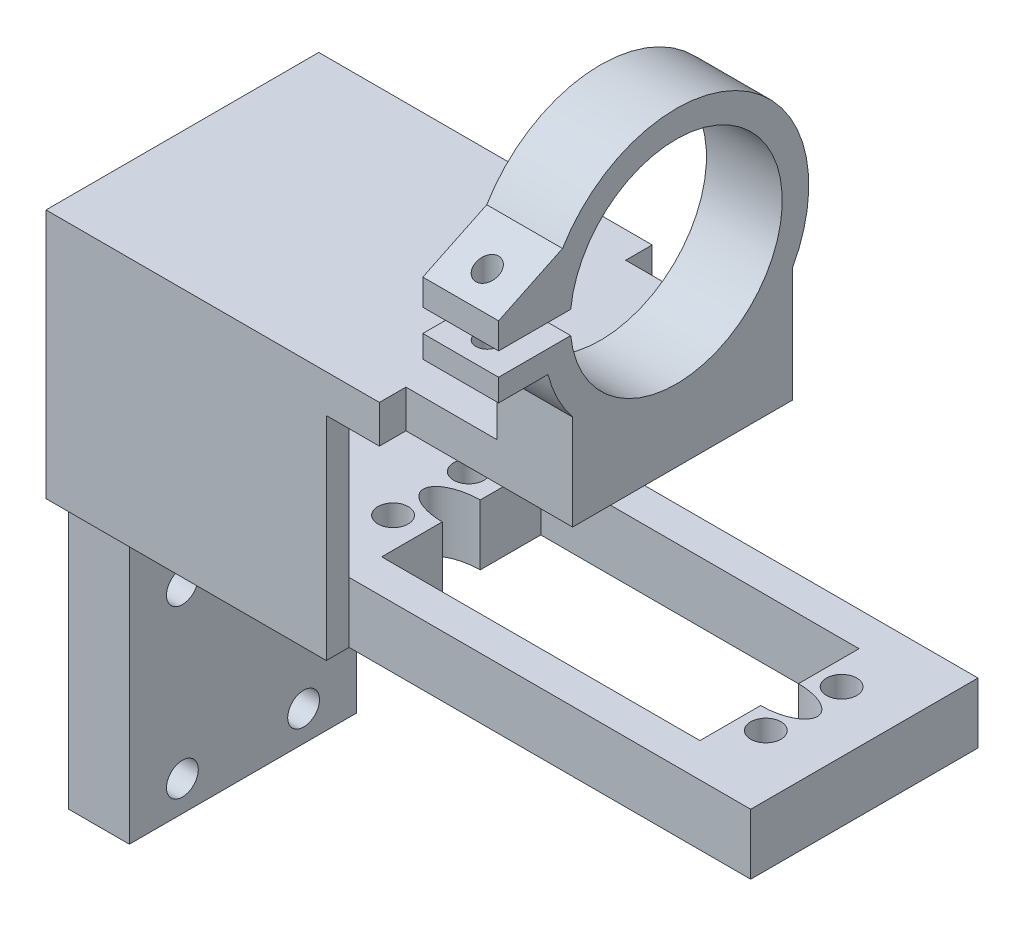
from build123d import *

# Parameters (mm, degrees)
SKETCH_1_W          = 82
SKETCH_1_H          = 30
EXTRUDE_1_DEPTH     = 8
SKETCH_2_R          = 2
CUT_EXTRUDE_1_DEPTH = 8
SKETCH_4_W          = 8
SKETCH_4_H          = 30
EXTRUDE_2_DEPTH     = 45
EXTRUDE_5_DEPTH     = 30
SKETCH_15_R         = 2.1
CUT_EXTRUDE_2_DEPTH = 10
SKETCH_17_W         = 37
SKETCH_17_H         = 3
EXTRUDE_6_DEPTH     = 20
EXTRUDE_6_2_DEPTH   = 20
SKETCH_18_W         = 66
SKETCH_18_H         = 36
EXTRUDE_7_DEPTH     = 5
SKETCH_19_W         = 37
SKETCH_19_H         = 3
EXTRUDE_8_DEPTH     = 8
SKETCH_20_W         = 22
SKETCH_20_H         = 3.5
CUT_EXTRUDE_3_DEPTH = 5
SKETCH_21_R         = 17.5
SKETCH_21_R_2       = 14
EXTRUDE_9_DEPTH     = 10
SKETCH_22_W         = 7.811366884
SKETCH_22_H         = 3
CUT_EXTRUDE_4_DEPTH = 10
EXTRUDE_10_DEPTH    = 10
SKETCH_24_R         = 1.5
CUT_EXTRUDE_5_DEPTH = 13


with BuildPart() as part:
    # 草圖1 → 填料-伸長1 (new body)
    with BuildSketch(Plane(origin=(0, 0, 0), x_dir=(1, 0, 0), z_dir=(0, 1, 0))):
        with Locations((41, 15)):
            Rectangle(SKETCH_1_W, SKETCH_1_H)
    extrude(amount=EXTRUDE_1_DEPTH)

    # 草圖2 → 除料-伸長1 (cut)
    with BuildSketch(Plane(origin=(0, 8, 0), x_dir=(1, 0, 0), z_dir=(0, 1, 0))):
        with Locations(Location((74, 20, 0), (0, 0, 270))):
            Circle(SKETCH_2_R)
        with Locations(Location((74, 10, 0), (0, 0, 270))):
            Circle(SKETCH_2_R)
        with Locations(Location((24.8, 20, 0), (0, 0, 270))):
            Circle(SKETCH_2_R)
        with Locations(Location((24.8, 10, 0), (0, 0, 270))):
            Circle(SKETCH_2_R)
        with BuildLine():
            Line((28.8, 25.5), (70.8, 25.5))
            Line((70.8, 25.5), (70.8, 17.5))
            add(Edge.make_bspline(
                [(70.8, 12.5), (75.8, 12.5), (75.8, 15), (75.8, 17.5), (70.8, 17.5)],
                knots=[4.71238898, 4.71238898, 4.71238898, 6.283185307, 6.283185307, 7.853981634, 7.853981634, 7.853981634], degree=2, weights=[1, 0.707106781, 1, 0.707106781, 1]))
            Line((70.8, 12.5), (70.8, 4.5))
            Line((70.8, 4.5), (28.8, 4.5))
            Line((28.8, 4.5), (28.8, 12.5))
            add(Edge.make_bspline(
                [(28.8, 17.5), (23.8, 17.5), (23.8, 15), (23.8, 12.5), (28.8, 12.5)],
                knots=[1.570796327, 1.570796327, 1.570796327, 3.141592654, 3.141592654, 4.71238898, 4.71238898, 4.71238898], degree=2, weights=[1, 0.707106781, 1, 0.707106781, 1]))
            Line((28.8, 17.5), (28.8, 25.5))
        make_face()
    extrude(amount=-CUT_EXTRUDE_1_DEPTH, mode=Mode.SUBTRACT)

    # 草圖4 → 填料-伸長2 (add)
    with BuildSketch(Plane(origin=(0, 8, 0), x_dir=(1, 0, 0), z_dir=(0, 1, 0))):
        with Locations((-4, 15)):
            Rectangle(SKETCH_4_W, SKETCH_4_H)
    extrude(amount=-EXTRUDE_2_DEPTH)

    # 草圖14 → 填料-伸長5 (add)
    with BuildSketch(Plane.XY):
        Polygon((0, 0), (0, -2), (2, 0), align=None)
    extrude(amount=-EXTRUDE_5_DEPTH)

    # 草圖15 → 除料-伸長2 (cut)
    with BuildSketch(Plane(origin=(0, 0, 0), x_dir=(0, 0, -1), z_dir=(1, 0, 0))):
        with Locations((7, -33)):
            Circle(SKETCH_15_R)
        with Locations((7, -11)):
            Circle(SKETCH_15_R)
        with Locations((23, -11)):
            Circle(SKETCH_15_R)
        with Locations((23, -33)):
            Circle(SKETCH_15_R)
    extrude(amount=-CUT_EXTRUDE_2_DEPTH, mode=Mode.SUBTRACT)



with BuildPart() as body_2:
    # 草圖17 → 填料-伸長6 (new body)
    with BuildSketch(Plane(origin=(0, 8, 0), x_dir=(1, 0, 0), z_dir=(0, 1, 0))):
        with Locations((10.5, -1.5)):
            Rectangle(SKETCH_17_W, SKETCH_17_H)
    extrude(amount=EXTRUDE_6_DEPTH)



with BuildPart() as body_3:
    # 草圖17 → Extrude 6 2 (new body)
    with BuildSketch(Plane(origin=(0, 8, 0), x_dir=(1, 0, 0), z_dir=(0, 1, 0))):
        with Locations((10.5, 31.5)):
            Rectangle(SKETCH_17_W, SKETCH_17_H)
    extrude(amount=EXTRUDE_6_2_DEPTH)


with BuildPart() as body_2_1:
    add(body_2.part)

    add(body_3.part)  # 填料-伸長7 merges body 3
    # 草圖18 → 填料-伸長7 (add)
    with BuildSketch(Plane(origin=(0, 28, 0), x_dir=(1, 0, 0), z_dir=(0, 1, 0))):
        with Locations((25, 15)):
            Rectangle(SKETCH_18_W, SKETCH_18_H)
    extrude(amount=EXTRUDE_7_DEPTH)


with BuildPart() as part_1:
    add(part.part)

    add(body_2_1.part)  # 填料-伸長8 merges body 2
    # 草圖19 → 填料-伸長8 (add)
    with BuildSketch(Plane(origin=(0, 8, 0), x_dir=(-1, 0, 0), z_dir=(0, -1, 0))):
        with Locations((-10.5, -1.5)):
            Rectangle(SKETCH_19_W, SKETCH_19_H)
        with Locations((-10.5, 31.5)):
            Rectangle(SKETCH_19_W, SKETCH_19_H)
    extrude(amount=EXTRUDE_8_DEPTH)

    # 草圖20 → 除料-伸長3 (cut)
    with BuildSketch(Plane(origin=(0, 33, 0), x_dir=(1, 0, 0), z_dir=(0, 1, 0))):
        with Locations((47, 31.25)):
            Rectangle(SKETCH_20_W, SKETCH_20_H)
        with Locations((47, -1.25)):
            Rectangle(SKETCH_20_W, SKETCH_20_H)
    extrude(amount=-CUT_EXTRUDE_3_DEPTH, mode=Mode.SUBTRACT)



with BuildPart() as body_2_2:
    # 草圖21 → 填料-伸長9 (new body)
    with BuildSketch(Plane(origin=(58, 0, 0), x_dir=(0, 0, -1), z_dir=(1, 0, 0))):
        with Locations((14.166762284, 51.5)):
            Circle(SKETCH_21_R)
        with Locations((14.166762284, 51.5)):
            Circle(SKETCH_21_R_2, mode=Mode.SUBTRACT)
    extrude(amount=-EXTRUDE_9_DEPTH)

    # 草圖22 → 除料-伸長4 (cut)
    with BuildSketch(Plane(origin=(58, 0, 0), x_dir=(0, 0, -1), z_dir=(1, 0, 0))):
        with Locations((-1.754307307, 51.514473438)):
            Rectangle(SKETCH_22_W, SKETCH_22_H)
    extrude(amount=-CUT_EXTRUDE_4_DEPTH, mode=Mode.SUBTRACT)


with BuildPart() as part_2:
    add(part_1.part)

    add(body_2_2.part)  # 填料-伸長10 merges body 2 2
    # 草圖23 → 填料-伸長10 (add)
    with BuildSketch(Plane(origin=(58, 0, 0), x_dir=(0, 0, -1), z_dir=(1, 0, 0))):
        Polygon((-3.267582275, 53.014473438), (-9.267582275, 53.014473438), (-9.267582275, 56.457912588), (-0.835356574, 60.510351257), align=None)
        Polygon((-3.270072602, 50.014473438), (-9.270072602, 50.014473438), (-9.270072602, 47.072613572), (-2.763927289, 47.072613572), align=None)
        Polygon((0.5, 33), (0.5, 40.569784601), (14.166762284, 34), (25.377489966, 38.062381727), (29.5, 43.065438888), (29.5, 33), align=None)
    extrude(amount=-EXTRUDE_10_DEPTH)

    # 草圖24 → 除料-伸長5 (cut)
    with BuildSketch(Plane(origin=(0, 47.072613572, 0), x_dir=(-1, 0, 0), z_dir=(0, -1, 0))):
        with Locations(Location((-53, -5.763927289, 0), (0, 0, 90))):
            Circle(SKETCH_24_R)
    extrude(amount=-CUT_EXTRUDE_5_DEPTH, mode=Mode.SUBTRACT)


solid = part_2.part
